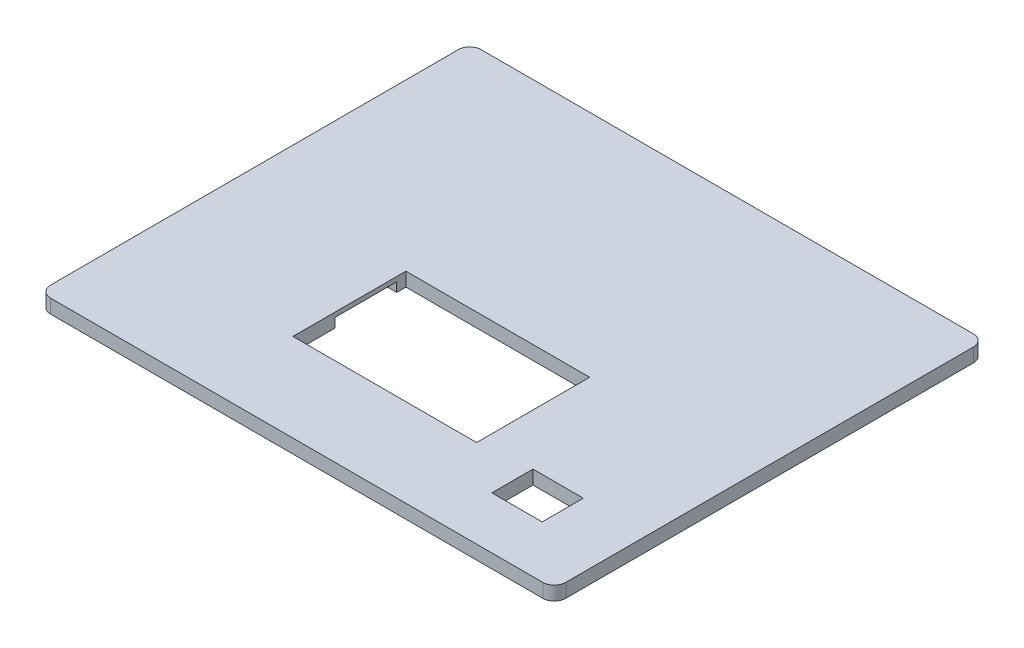
from build123d import *

# Parameters (mm, degrees)
SKETCH_1_W               = 670
SKETCH_1_H               = 560
EXTRUDE_1_DEPTH          = 18
CUT_EXTRUDE_1_DEPTH      = 653.80088848
CUT_EXTRUDE_1_DEPTH_BACK = 653.80088848
SKETCH_2_W               = 65.5
SKETCH_2_H               = 53.5
CUT_EXTRUDE_2_DEPTH      = 653.80088848
CUT_EXTRUDE_2_DEPTH_BACK = 653.80088848
SKETCH_3_W               = 228
SKETCH_3_H               = 136
CUT_EXTRUDE_3_REACH      = 654.801
SKETCH_4_W               = 239
SKETCH_4_H               = 147
FILLET_1_R               = 15
SKETCH_8_W               = 80.472707968
SKETCH_8_H               = 80
CUT_EXTRUDE_4_DEPTH      = 12


with BuildPart() as part:
    # 草图1 → 凸台-拉伸1 (new body)
    with BuildSketch(Plane(origin=(0, 0, 0), x_dir=(1, 0, 0), z_dir=(0, 1, 0))):
        with Locations((0, 280)):
            Rectangle(SKETCH_1_W, SKETCH_1_H)
    extrude(amount=EXTRUDE_1_DEPTH)

    # 草图2 → 切除-拉伸1 (cut, two sides: drawn at the far end of the back side and taken through both)
    with BuildSketch(Plane(origin=(0, 18, 0), x_dir=(1, 0, 0), z_dir=(0, 1, 0)).offset(-CUT_EXTRUDE_1_DEPTH_BACK)):
        with Locations((218.822373939, 94.436899918)):
            Rectangle(SKETCH_2_W, SKETCH_2_H)
    extrude(amount=CUT_EXTRUDE_1_DEPTH + CUT_EXTRUDE_1_DEPTH_BACK, mode=Mode.SUBTRACT)

    # 草图3 → 切除-拉伸2 (cut, two sides: drawn at the far end of the back side and taken through both)
    with BuildSketch(Plane(origin=(0, 18, 0), x_dir=(1, 0, 0), z_dir=(0, 1, 0)).offset(-CUT_EXTRUDE_2_DEPTH_BACK)):
        with Locations((0, 188)):
            Rectangle(SKETCH_3_W, SKETCH_3_H)
    extrude(amount=CUT_EXTRUDE_2_DEPTH + CUT_EXTRUDE_2_DEPTH_BACK, mode=Mode.SUBTRACT)

    # 草图4 → 切除-拉伸3 (cut, up to next)
    with BuildSketch(Plane(origin=(0, 18, 0), x_dir=(1, 0, 0), z_dir=(0, 1, 0)), mode=Mode.PRIVATE) as cut_extrude_3_sk1:
        with Locations((0, 188)):
            Rectangle(SKETCH_4_W, SKETCH_4_H)
    cut_extrude_3_tool1 = extrude(cut_extrude_3_sk1.sketch, amount=-CUT_EXTRUDE_3_REACH, mode=Mode.PRIVATE) & part.part
    add(cut_extrude_3_tool1.solids().sort_by_distance((0, 18, -188))[0], mode=Mode.SUBTRACT)

    # 圆角1
    fillet_1_edges = [part.edges().sort_by_distance(p)[0] for p in [
        (-335, 9, -560),
        (335, 9, -560),
        (335, 9, 0),
        (-335, 9, 0),
    ]]
    fillet(fillet_1_edges, radius=FILLET_1_R)

    # 草图8 → 切除-拉伸4 (cut)
    with BuildSketch(Plane.XZ):
        with Locations((-159.736353984, -209.541384695)):
            Rectangle(SKETCH_8_W, SKETCH_8_H)
    extrude(amount=-CUT_EXTRUDE_4_DEPTH, mode=Mode.SUBTRACT)


solid = part.part
